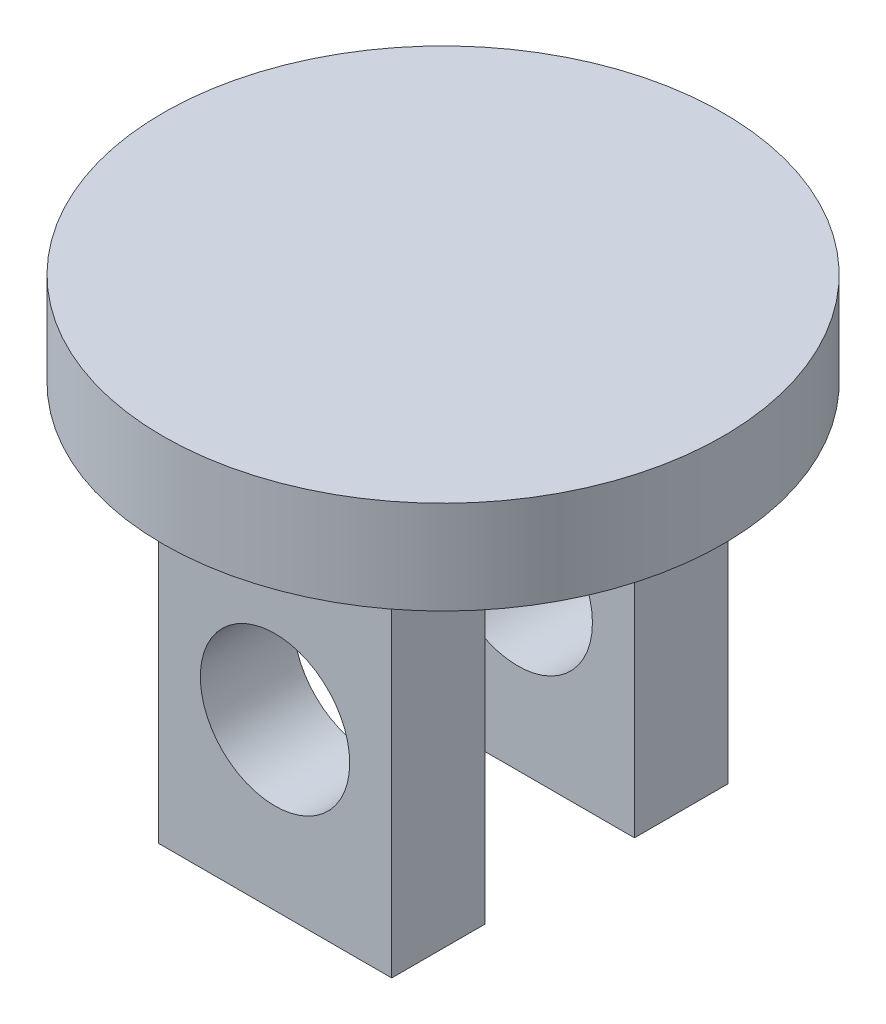
from build123d import *

# Parameters (mm, degrees)
SKETCH_1_R          = 6
EXTRUDE_1_DEPTH     = 2
SKETCH_1_3_W        = 5
SKETCH_1_3_H        = 2
EXTRUDE_2_DEPTH     = 8
SKETCH_2_R          = 1.6
CUT_EXTRUDE_1_DEPTH = 14.862178761


with BuildPart() as part:
    # 草图1 → 凸台-拉伸1 (new body)
    with BuildSketch(Plane(origin=(0, 0, 0), x_dir=(1, 0, 0), z_dir=(0, 1, 0))):
        Circle(SKETCH_1_R)
    extrude(amount=EXTRUDE_1_DEPTH)

    # 草图1<3> → 凸台-拉伸2 (add)
    with BuildSketch(Plane(origin=(0, 0, 0), x_dir=(1, 0, 0), z_dir=(0, 1, 0))):
        with Locations((0, 2.6)):
            Rectangle(SKETCH_1_3_W, SKETCH_1_3_H)
        with Locations((0, -2.6)):
            Rectangle(SKETCH_1_3_W, SKETCH_1_3_H)
    extrude(amount=-EXTRUDE_2_DEPTH)

    # 草图2 → 切除-拉伸1 (cut, through all)
    with BuildSketch(Plane.XY.offset(3.6)):
        with Locations((0, -4.46004136)):
            Circle(SKETCH_2_R)
    extrude(amount=-CUT_EXTRUDE_1_DEPTH, mode=Mode.SUBTRACT)


solid = part.part
